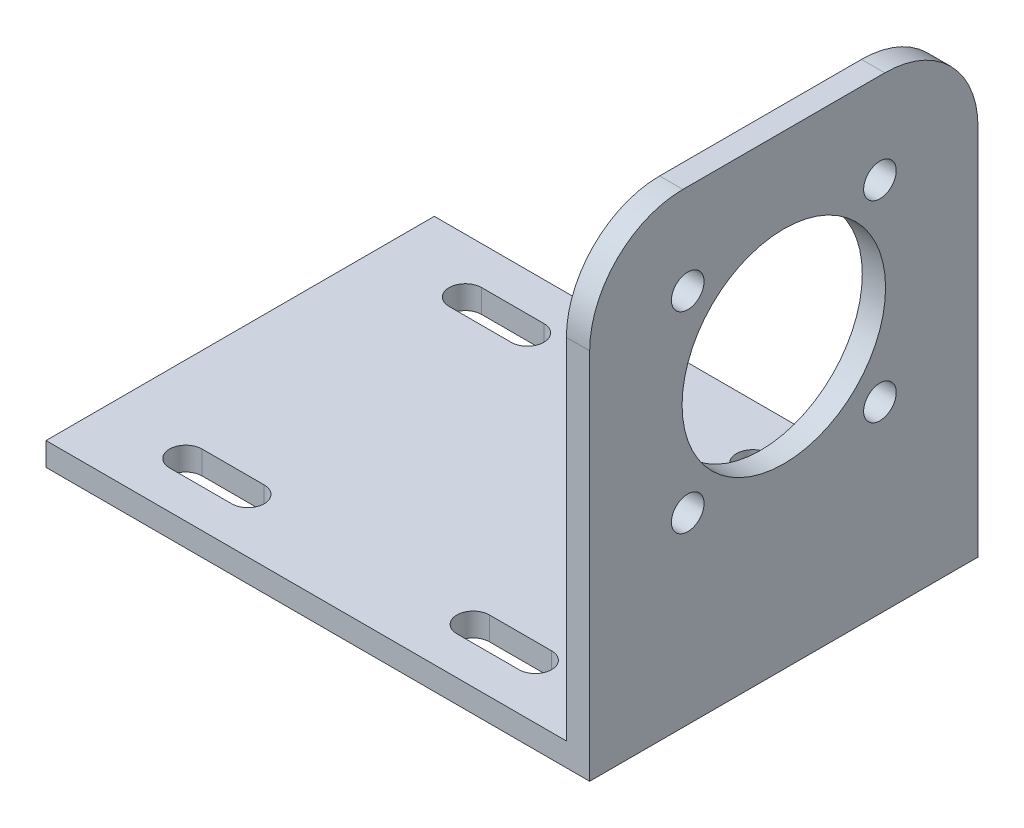
from build123d import *

# Parameters (mm, degrees)
EXTRUDE_1_DEPTH     = 25
CUT_EXTRUDE_1_REACH = 95.67
CUT_EXTRUDE_2_REACH = 95.67
SKETCH_3_R          = 13.1
SKETCH_3_R_2        = 2.1
FILLET_1_R          = 12


with BuildPart() as part:
    # 草图1 → 凸台-拉伸1 (new, symmetric)
    with BuildSketch(Plane.XY):
        Polygon((0, 0), (67, 0), (67, 57), (70, 57), (70, -3), (0, -3), align=None)
    extrude(amount=EXTRUDE_1_DEPTH, both=True)

    # 草图2 → 切除-拉伸1 (cut, up to next)
    with BuildSketch(Plane(origin=(0, 0, 0), x_dir=(1, 0, 0), z_dir=(0, 1, 0)), mode=Mode.PRIVATE) as cut_extrude_1_sk1:
        with BuildLine():
            Line((11, 20.1), (19, 20.1))
            ThreePointArc((19, 20.1), (21.1, 18), (19, 15.9))
            Line((19, 15.9), (11, 15.9))
            ThreePointArc((11, 15.9), (8.9, 18), (11, 20.1))
        make_face()
    cut_extrude_1_tool1 = extrude(cut_extrude_1_sk1.sketch, amount=-CUT_EXTRUDE_1_REACH, mode=Mode.PRIVATE) & part.part
    # 草图2 → 切除-拉伸1 (cut, up to next)
    with BuildSketch(Plane(origin=(0, 0, 0), x_dir=(1, 0, 0), z_dir=(0, 1, 0)), mode=Mode.PRIVATE) as cut_extrude_1_sk2:
        with BuildLine():
            Line((48, 20.1), (56, 20.1))
            ThreePointArc((56, 20.1), (58.1, 18), (56, 15.9))
            Line((56, 15.9), (48, 15.9))
            ThreePointArc((48, 15.9), (45.9, 18), (48, 20.1))
        make_face()
    cut_extrude_1_tool2 = extrude(cut_extrude_1_sk2.sketch, amount=-CUT_EXTRUDE_1_REACH, mode=Mode.PRIVATE) & part.part
    # 草图2 → 切除-拉伸1 (cut, up to next)
    with BuildSketch(Plane(origin=(0, 0, 0), x_dir=(1, 0, 0), z_dir=(0, 1, 0)), mode=Mode.PRIVATE) as cut_extrude_1_sk3:
        with BuildLine():
            Line((11, -20.1), (19, -20.1))
            ThreePointArc((19, -20.1), (21.1, -18), (19, -15.9))
            Line((19, -15.9), (11, -15.9))
            ThreePointArc((11, -15.9), (8.9, -18), (11, -20.1))
        make_face()
    cut_extrude_1_tool3 = extrude(cut_extrude_1_sk3.sketch, amount=-CUT_EXTRUDE_1_REACH, mode=Mode.PRIVATE) & part.part
    # 草图2 → 切除-拉伸1 (cut, up to next)
    with BuildSketch(Plane(origin=(0, 0, 0), x_dir=(1, 0, 0), z_dir=(0, 1, 0)), mode=Mode.PRIVATE) as cut_extrude_1_sk4:
        with BuildLine():
            Line((48, -20.1), (56, -20.1))
            ThreePointArc((56, -20.1), (58.1, -18), (56, -15.9))
            Line((56, -15.9), (48, -15.9))
            ThreePointArc((48, -15.9), (45.9, -18), (48, -20.1))
        make_face()
    cut_extrude_1_tool4 = extrude(cut_extrude_1_sk4.sketch, amount=-CUT_EXTRUDE_1_REACH, mode=Mode.PRIVATE) & part.part
    add(cut_extrude_1_tool1.solids().sort_by_distance((15, 0, -18))[0], mode=Mode.SUBTRACT)
    add(cut_extrude_1_tool2.solids().sort_by_distance((52, 0, -18))[0], mode=Mode.SUBTRACT)
    add(cut_extrude_1_tool3.solids().sort_by_distance((15, 0, 18))[0], mode=Mode.SUBTRACT)
    add(cut_extrude_1_tool4.solids().sort_by_distance((52, 0, 18))[0], mode=Mode.SUBTRACT)

    # 草图3 → 切除-拉伸2 (cut, up to next)
    with BuildSketch(Plane(origin=(0, 0, 0), x_dir=(0, 0, -1), z_dir=(1, 0, 0)), mode=Mode.PRIVATE) as cut_extrude_2_sk1:
        with Locations(Location((0, 33, 0), (0, 0, 270))):
            Circle(SKETCH_3_R)
    cut_extrude_2_tool1 = extrude(cut_extrude_2_sk1.sketch, amount=CUT_EXTRUDE_2_REACH, mode=Mode.PRIVATE) & part.part
    # 草图3 → 切除-拉伸2 (cut, up to next)
    with BuildSketch(Plane(origin=(0, 0, 0), x_dir=(0, 0, -1), z_dir=(1, 0, 0)), mode=Mode.PRIVATE) as cut_extrude_2_sk2:
        with Locations(Location((12.374368671, 45.374368671, 0), (0, 0, 270))):
            Circle(SKETCH_3_R_2)
    cut_extrude_2_tool2 = extrude(cut_extrude_2_sk2.sketch, amount=CUT_EXTRUDE_2_REACH, mode=Mode.PRIVATE) & part.part
    # 草图3 → 切除-拉伸2 (cut, up to next)
    with BuildSketch(Plane(origin=(0, 0, 0), x_dir=(0, 0, -1), z_dir=(1, 0, 0)), mode=Mode.PRIVATE) as cut_extrude_2_sk3:
        with Locations(Location((12.374368671, 20.625631329, 0), (0, 0, 270))):
            Circle(SKETCH_3_R_2)
    cut_extrude_2_tool3 = extrude(cut_extrude_2_sk3.sketch, amount=CUT_EXTRUDE_2_REACH, mode=Mode.PRIVATE) & part.part
    # 草图3 → 切除-拉伸2 (cut, up to next)
    with BuildSketch(Plane(origin=(0, 0, 0), x_dir=(0, 0, -1), z_dir=(1, 0, 0)), mode=Mode.PRIVATE) as cut_extrude_2_sk4:
        with Locations(Location((-12.374368671, 20.625631329, 0), (0, 0, 270))):
            Circle(SKETCH_3_R_2)
    cut_extrude_2_tool4 = extrude(cut_extrude_2_sk4.sketch, amount=CUT_EXTRUDE_2_REACH, mode=Mode.PRIVATE) & part.part
    # 草图3 → 切除-拉伸2 (cut, up to next)
    with BuildSketch(Plane(origin=(0, 0, 0), x_dir=(0, 0, -1), z_dir=(1, 0, 0)), mode=Mode.PRIVATE) as cut_extrude_2_sk5:
        with Locations(Location((-12.374368671, 45.374368671, 0), (0, 0, 270))):
            Circle(SKETCH_3_R_2)
    cut_extrude_2_tool5 = extrude(cut_extrude_2_sk5.sketch, amount=CUT_EXTRUDE_2_REACH, mode=Mode.PRIVATE) & part.part
    add(cut_extrude_2_tool1.solids().sort_by_distance((0, 33, 0))[0], mode=Mode.SUBTRACT)
    add(cut_extrude_2_tool2.solids().sort_by_distance((0, 45.374369, -12.374369))[0], mode=Mode.SUBTRACT)
    add(cut_extrude_2_tool3.solids().sort_by_distance((0, 20.625631, -12.374369))[0], mode=Mode.SUBTRACT)
    add(cut_extrude_2_tool4.solids().sort_by_distance((0, 20.625631, 12.374369))[0], mode=Mode.SUBTRACT)
    add(cut_extrude_2_tool5.solids().sort_by_distance((0, 45.374369, 12.374369))[0], mode=Mode.SUBTRACT)

    # 圆角1
    fillet_1_edges = [part.edges().sort_by_distance(p)[0] for p in [
        (68.5, 57, 25),
        (68.5, 57, -25),
    ]]
    fillet(fillet_1_edges, radius=FILLET_1_R)


solid = part.part
